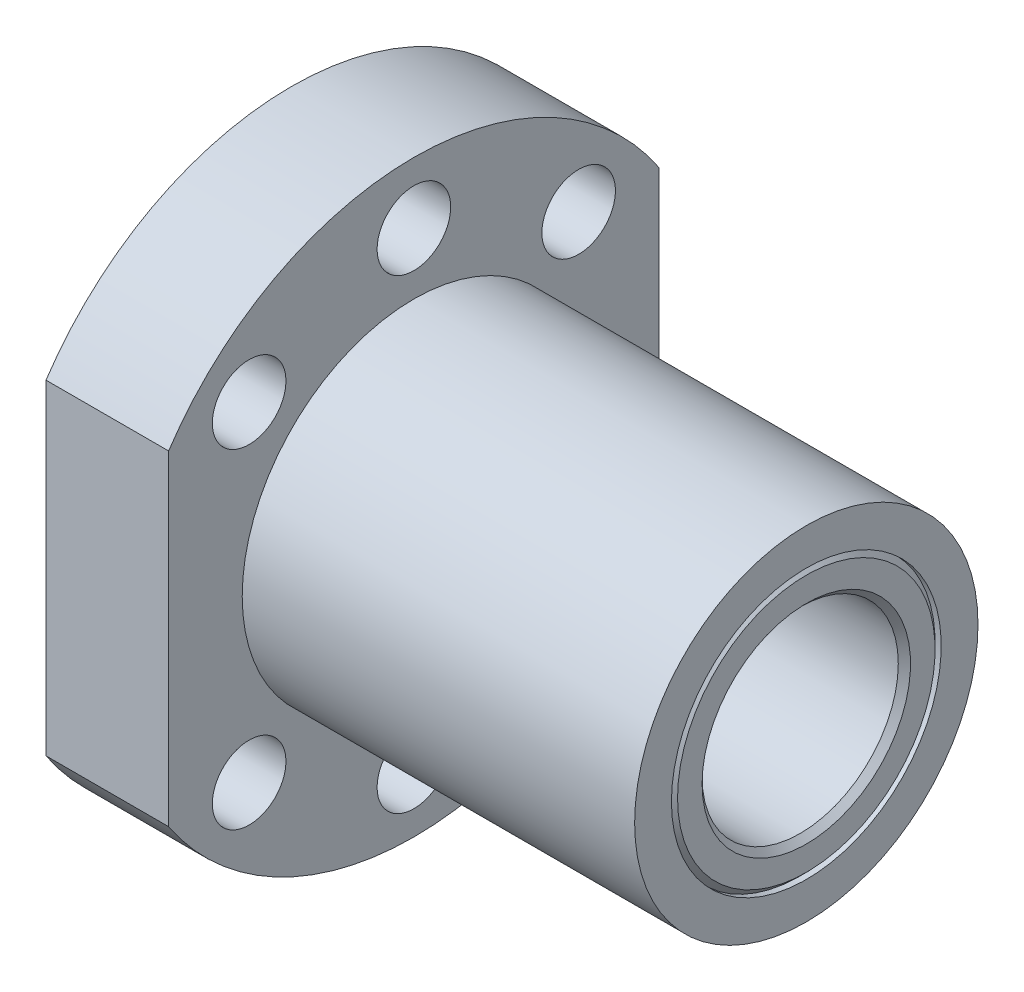
from build123d import *

# Parameters (mm, degrees)
SKETCH_2_W          = 60
SKETCH_2_H          = 68
SKETCH_2_W_2        = 40
SKETCH_2_H_2        = 48
CUT_EXTRUDE_1_DEPTH = 55
SKETCH_3_R          = 3
CUT_EXTRUDE_2_DEPTH = 53.345009313
SKETCH_4_R          = 11
SKETCH_4_R_2        = 8
EXTRUDE_1_DEPTH     = 42
CHAMFER_1_SIZE      = 0.5


with BuildPart() as part:
    # Эскиз1 → Повернуть1 (revolve)
    with BuildSketch(Plane.XY, mode=Mode.PRIVATE) as revolve_1_sk:
        Polygon((0, 11), (0, 24), (10, 24), (10, 14), (42, 14), (42, 11), align=None)
    revolve(revolve_1_sk.sketch.rotate(Axis((0, 0, 0), (1, 0, 0)), 90), axis=Axis((0, 0, 0), (1, 0, 0)))

    # Эскиз2 → Вырез-Вытянуть1 (cut, through all)
    with BuildSketch(Plane.ZY):
        Rectangle(SKETCH_2_W, SKETCH_2_H)
        Rectangle(SKETCH_2_W_2, SKETCH_2_H_2, mode=Mode.SUBTRACT)
    extrude(amount=-CUT_EXTRUDE_1_DEPTH, mode=Mode.SUBTRACT)

    # Эскиз3 → Вырез-Вытянуть2 (cut, through all)
    with BuildSketch(Plane.ZY):
        with Locations((0, 19)):
            Circle(SKETCH_3_R)
        with Locations((13.435028843, 13.435028843)):
            Circle(SKETCH_3_R)
        with Locations((-13.435028843, 13.435028843)):
            Circle(SKETCH_3_R)
        with Locations((-13.435028843, -13.435028843)):
            Circle(SKETCH_3_R)
        with Locations((0, -19)):
            Circle(SKETCH_3_R)
        with Locations((13.435028843, -13.435028843)):
            Circle(SKETCH_3_R)
    extrude(amount=-CUT_EXTRUDE_2_DEPTH, mode=Mode.SUBTRACT)


with BuildPart() as body_2:
    # Эскиз4 → Бобышка-Вытянуть1 (new body)
    with BuildSketch(Plane(origin=(0, 0, 0), x_dir=(0, 0, -1), z_dir=(1, 0, 0))):
        with Locations(Location((0, 0, 0), (0, 0, 180))):
            Circle(SKETCH_4_R)
        with Locations(Location((0, 0, 0), (0, 0, 180))):
            Circle(SKETCH_4_R_2, mode=Mode.SUBTRACT)
    extrude(amount=EXTRUDE_1_DEPTH)

    # Фаска1
    chamfer_1_edges = [body_2.edges().sort_by_distance(p)[0] for p in [
        (0, 0, -8),
        (0, 0, -11),
        (42, 0, -11),
        (42, 0, -8),
    ]]
    chamfer(chamfer_1_edges, length=CHAMFER_1_SIZE)


solid = Compound([part.part, body_2.part])
